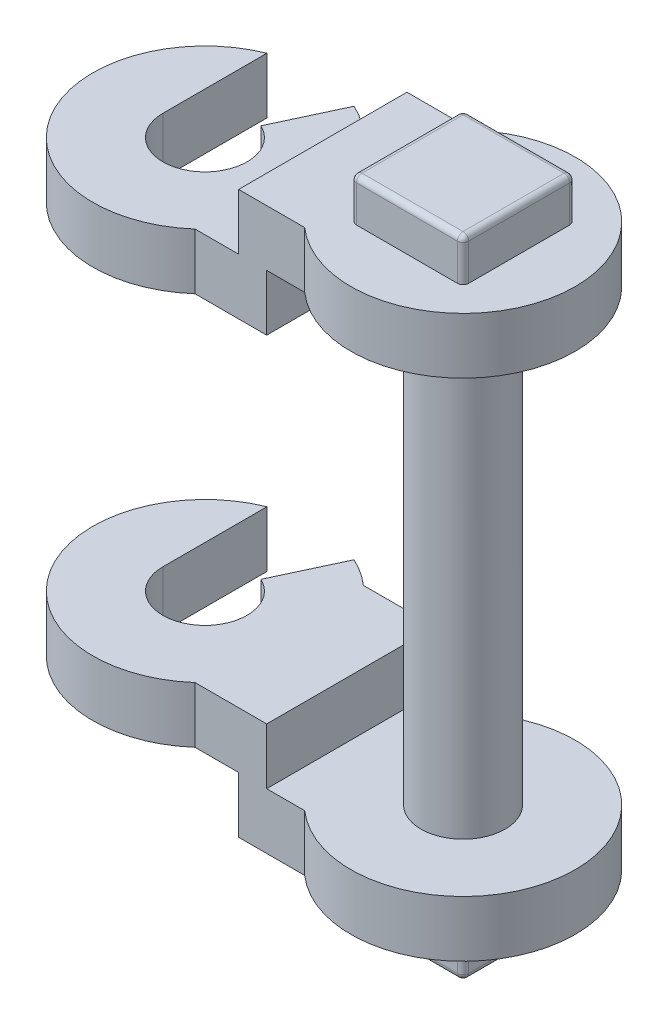
from build123d import *

# Parameters (mm, degrees)
EXTRUDE_1_DEPTH      = 4
EXTRUDE_1_DEPTH_BACK = 4
SKETCH_1_R           = 0.75
SKETCH_2_R           = 2
EXTRUDE_2_DEPTH      = 1
EXTRUDE_START        = 1
SKETCH_3_R           = 2
EXTRUDE_3_DEPTH      = 1
SKETCH_4_W           = 2
SKETCH_4_H           = 2
EXTRUDE_4_DEPTH      = 0.75
SKETCH_5_W           = 2
SKETCH_5_H           = 2
EXTRUDE_5_DEPTH      = 0.75
SKETCH_6_W           = 1.5
SKETCH_6_H           = 3
EXTRUDE_6_DEPTH      = 1
SKETCH_7_W           = 1.5
SKETCH_7_H           = 3
EXTRUDE_8_DEPTH      = 1
SKETCH_8_W           = 3
SKETCH_8_H           = 2
EXTRUDE_9_DEPTH      = 0.5
EXTRUDE_10_DEPTH     = 1
EXTRUDE_START_2      = 7
EXTRUDE_11_DEPTH     = 1
CUT_EXTRUDE_1_DEPTH  = 12.942466244
FILLET_1_R           = 0.1


with BuildPart() as part:
    # 草图1 → 凸台-拉伸1 (new, two sides: drawn at the far end of the back side and taken through both)
    with BuildSketch(Plane(origin=(0, 0, 0), x_dir=(1, 0, 0), z_dir=(0, 1, 0)).offset(-EXTRUDE_1_DEPTH_BACK)):
        with Locations(Location((0, 0, 0), (0, 0, 270))):
            Circle(SKETCH_1_R)
    extrude(amount=EXTRUDE_1_DEPTH + EXTRUDE_1_DEPTH_BACK)

    # 草图2 → 凸台-拉伸2 (add)
    with BuildSketch(Plane(origin=(0, 4, 0), x_dir=(-1, 0, 0), z_dir=(0, 1, 0))):
        with Locations(Location((0, 0, 0), (0, 0, 90))):
            Circle(SKETCH_2_R)
    extrude(amount=EXTRUDE_2_DEPTH)

    # 草图3 → 凸台-拉伸3 (add)
    with BuildSketch(Plane.XZ.offset(4).offset(EXTRUDE_START)):
        with Locations(Location((0, 0, 0), (0, 0, 90))):
            Circle(SKETCH_3_R)
    extrude(amount=-EXTRUDE_3_DEPTH)

    # 草图4 → 凸台-拉伸4 (add)
    with BuildSketch(Plane(origin=(0, 5, 0), x_dir=(-1, 0, 0), z_dir=(0, 1, 0))):
        Rectangle(SKETCH_4_W, SKETCH_4_H)
    extrude(amount=EXTRUDE_4_DEPTH)

    # 草图5 → 凸台-拉伸5 (add)
    with BuildSketch(Plane.XZ.offset(5)):
        Rectangle(SKETCH_5_W, SKETCH_5_H)
    extrude(amount=EXTRUDE_5_DEPTH)

    # 草图6 → 凸台-拉伸6 (add)
    with BuildSketch(Plane(origin=(0, 5, 0), x_dir=(-1, 0, 0), z_dir=(0, 1, 0))):
        with Locations((1.75, 0)):
            Rectangle(SKETCH_6_W, SKETCH_6_H)
    extrude(amount=-EXTRUDE_6_DEPTH)

    # 草图7 → 凸台-拉伸8 (add)
    with BuildSketch(Plane.XZ.offset(5)):
        with Locations((-1.75, 0)):
            Rectangle(SKETCH_7_W, SKETCH_7_H)
    extrude(amount=-EXTRUDE_8_DEPTH)

    # 草图8 → 凸台-拉伸9 (add)
    with BuildSketch(Plane.ZY.offset(2.5)):
        with Locations((0, 4)):
            Rectangle(SKETCH_8_W, SKETCH_8_H)
        with Locations((0, -4)):
            Rectangle(SKETCH_8_W, SKETCH_8_H)
    extrude(amount=-EXTRUDE_9_DEPTH)

    # 草图9 → 凸台-拉伸10 (add)
    with BuildSketch(Plane.XZ.offset(-3)):
        with BuildLine():
            Line((-2.5, -1.5), (-3.277124344, -1.5))
            ThreePointArc((-3.277124344, -1.5), (-6.6, 0), (-3.277124344, 1.5))
            Line((-3.277124344, 1.5), (-2.5, 1.5))
            Line((-2.5, 1.5), (-2.5, -1.5))
        make_face()
    extrude(amount=-EXTRUDE_10_DEPTH)

    # 草图9<2> → 凸台-拉伸11 (add)
    with BuildSketch(Plane.XZ.offset(-3).offset(EXTRUDE_START_2)):
        with BuildLine():
            Line((-2.5, -1.5), (-3.277124344, -1.5))
            ThreePointArc((-3.277124344, -1.5), (-6.6, 0), (-3.277124344, 1.5))
            Line((-3.277124344, 1.5), (-2.5, 1.5))
            Line((-2.5, 1.5), (-2.5, -1.5))
        make_face()
    extrude(amount=-EXTRUDE_11_DEPTH)

    # 草图10 → 切除-拉伸1 (cut, through all)
    with BuildSketch(Plane(origin=(0, 4, 0), x_dir=(-1, 0, 0), z_dir=(0, 1, 0))):
        with BuildLine():
            Line((5.35, 0), (5.35, -1.854049622))
            ThreePointArc((5.35, -1.854049622), (4.548070298, -1.999325713), (3.754763477, -1.812615574))
            Line((3.754763477, -1.812615574), (4.283036304, -0.67973084))
            ThreePointArc((4.283036304, -0.67973084), (4.197025294, 0.632543584), (5.35, 0))
        make_face()
    extrude(amount=-CUT_EXTRUDE_1_DEPTH, mode=Mode.SUBTRACT)

    # 圆角1
    fillet_1_edges = [part.edges().sort_by_distance(p)[0] for p in [
        (1, 5.375, 1),
        (1, 5.375, -1),
        (-1, 5.375, -1),
        (-1, 5.375, 1),
        (1, 5.75, 0),
        (0, 5.75, -1),
        (-1, 5.75, 0),
        (0, 5.75, 1),
        (-1, -5.375, 1),
        (-1, -5.375, -1),
        (1, -5.375, -1),
        (1, -5.375, 1),
        (-1, -5.75, 0),
        (0, -5.75, -1),
        (1, -5.75, 0),
        (0, -5.75, 1),
    ]]
    fillet(fillet_1_edges, radius=FILLET_1_R)


solid = part.part
